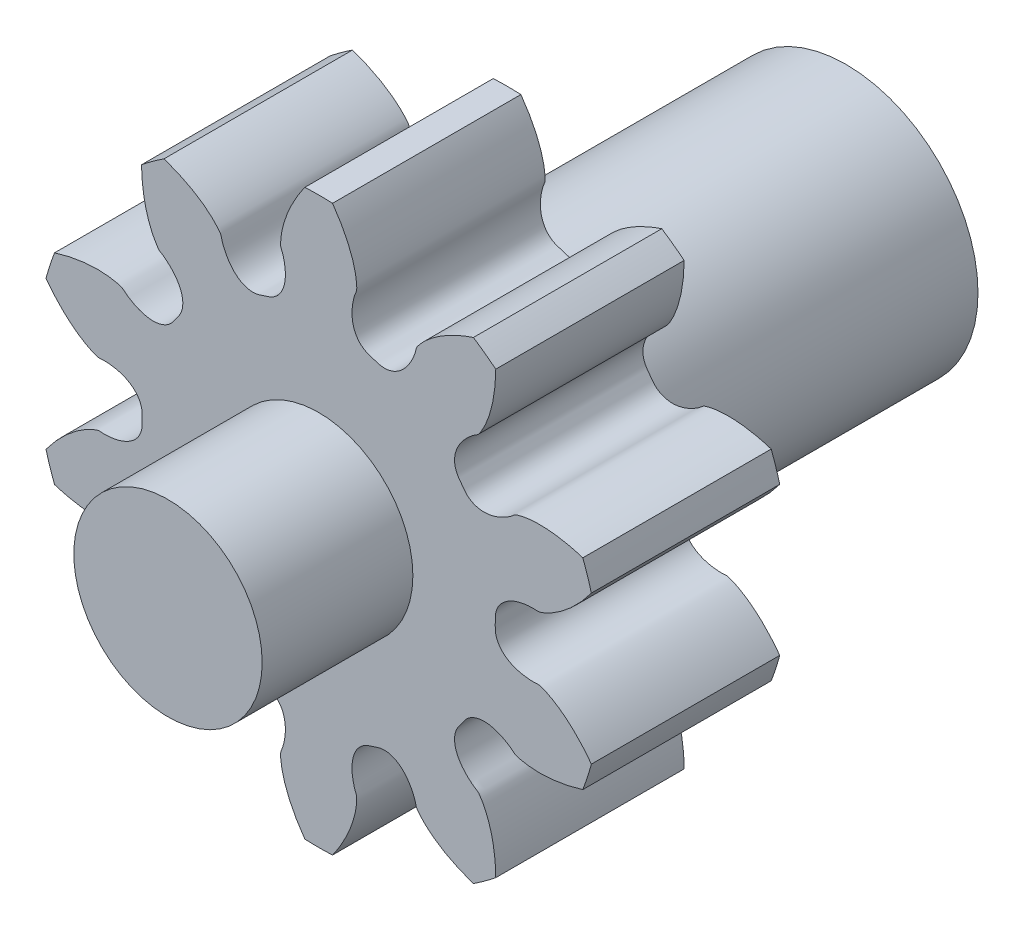
from build123d import *

# Parameters (mm, degrees)
SKETCHREVOLVESPURPINION_W       = 10
SKETCHREVOLVESPURPINION_H       = 15
TOOTHEXTRUDECUTSPURPINION_DEPTH = 5
PATTERNSPURPINION_COUNT         = 10
SKETCH3_R                       = 5
BOSS_EXTRUDE1_DEPTH             = 8
SKETCH4_R                       = 7
BOSS_EXTRUDE2_DEPTH             = 18
CUT_EXTRUDE2_DEPTH              = 15


with BuildPart() as part:
    # SketchRevolveSpurPinion → SpurPinion (revolve)
    with BuildSketch(Plane(origin=(0, 0, 0), x_dir=(0, 0, -1), z_dir=(1, 0, 0)), mode=Mode.PRIVATE) as spurpinion_sk:
        with Locations((0, 7.5)):
            Rectangle(SKETCHREVOLVESPURPINION_W, SKETCHREVOLVESPURPINION_H)
    revolve(spurpinion_sk.sketch.rotate(Axis((0, 0, 0), (0, 0, -1)), 90), axis=Axis((0, 0, 0), (0, 0, -1)))

    # SketchToothSpurPinion → ToothExtrudeCutSpurPinion (cut, symmetric)
    with BuildSketch(Plane.XY):
        with BuildLine():
            ThreePointArc((14.569567696, 4.061197133), (15.125, 0), (14.569567696, -4.061197133))
            add(Edge.make_bspline(
                [(14.569567696, -4.061197133), (14.427859874, -3.861632553), (14.209673665, -3.578045748), (13.904418686, -3.22876315), (13.684999286, -2.997332339), (13.470240269, -2.788455698), (13.261586972, -2.601352826), (13.060428263, -2.435163887), (12.868092511, -2.288952382), (12.685843528, -2.161712646), (12.514877767, -2.05236001), (12.356318142, -1.959778869), (12.211219584, -1.882685067), (12.080538286, -1.820076681), (11.965214456, -1.769860456), (11.842832435, -1.724424039), (11.649179793, -1.649342105), (11.434569911, -1.696941934), (11.239080863, -1.683850658), (11.11883073, -1.675708103), (11.001574361, -1.662620506), (10.887187648, -1.645922904), (10.775720498, -1.625282664), (10.667170857, -1.600776991), (10.561545218, -1.572348483), (10.458845742, -1.53994129), (10.359077942, -1.503459489), (10.262255057, -1.462771216), (10.16840608, -1.417700573), (10.077586537, -1.368023104), (9.989893335, -1.3134618), (9.905484435, -1.253686303), (9.824604013, -1.188317439), (9.747613068, -1.116940646), (9.675023698, -1.039132755), (9.607533684, -0.954507059), (9.546050385, -0.862780951), (9.49170341, -0.763865715), (9.445785092, -0.657974866), (9.409779592, -0.545719815), (9.384800939, -0.428213973), (9.374373909, -0.320691454), (9.370444082, -0.177657223), (9.378345923, 0), (9.370444082, 0.177657223), (9.374373909, 0.320691454), (9.384800939, 0.428213973), (9.409779592, 0.545719815), (9.445785092, 0.657974866), (9.49170341, 0.763865715), (9.546050385, 0.862780951), (9.607533684, 0.954507059), (9.675023698, 1.039132755), (9.747613068, 1.116940646), (9.824604013, 1.188317439), (9.905484435, 1.253686303), (9.989893335, 1.3134618), (10.077586537, 1.368023104), (10.16840608, 1.417700573), (10.262255057, 1.462771216), (10.359077942, 1.503459489), (10.458845742, 1.53994129), (10.561545218, 1.572348483), (10.667170857, 1.600776991), (10.775720498, 1.625282664), (10.887187648, 1.645922904), (11.001574361, 1.662620506), (11.11883073, 1.675708103), (11.239080863, 1.683850658), (11.434569911, 1.696941934), (11.649179793, 1.649342105), (11.842832435, 1.724424039), (11.965214456, 1.769860456), (12.080538286, 1.820076681), (12.211219584, 1.882685067), (12.356318142, 1.959778869), (12.514877767, 2.05236001), (12.685843528, 2.161712646), (12.868092511, 2.288952382), (13.060428263, 2.435163887), (13.261586972, 2.601352826), (13.470240269, 2.788455698), (13.684999286, 2.997332339), (13.904418686, 3.22876315), (14.209673665, 3.578045748), (14.427859874, 3.861632553), (14.569567696, 4.061197133)],
                knots=[0, 0, 0, 0, 0.05171016, 0.07552405, 0.097977146, 0.119069449, 0.138800958, 0.157171673, 0.174181594, 0.189830722, 0.204119057, 0.217046597, 0.228613344, 0.238819298, 0.247664458, 0.255148825, 0.266491119, 0.290788773, 0.29945532, 0.307936773, 0.316241042, 0.324377015, 0.332354693, 0.340185343, 0.347881664, 0.355457971, 0.362930389, 0.370317039, 0.377638219, 0.384916533, 0.392176948, 0.399446703, 0.406754997, 0.414132351, 0.421609511, 0.429215785, 0.43697672, 0.444911182, 0.453028093, 0.461323375, 0.469777943, 0.478357658, 0.484105593, 0.5, 0.515894407, 0.521642342, 0.530222057, 0.538676625, 0.546971907, 0.555088818, 0.56302328, 0.570784215, 0.578390489, 0.585867649, 0.593245003, 0.600553297, 0.607823052, 0.615083467, 0.622361781, 0.629682961, 0.637069611, 0.644542029, 0.652118336, 0.659814657, 0.667645307, 0.675622985, 0.683758958, 0.692063227, 0.70054468, 0.709211227, 0.733508881, 0.744851175, 0.752335542, 0.761180702, 0.771386656, 0.782953403, 0.795880943, 0.810169278, 0.825818406, 0.842828327, 0.861199042, 0.880930551, 0.902022854, 0.92447595, 0.94828984, 1, 1, 1, 1], degree=3))
        make_face()
    toothextrudecutspurpinion = extrude(amount=TOOTHEXTRUDECUTSPURPINION_DEPTH, both=True, mode=Mode.SUBTRACT)

    # PatternSpurPinion: ToothExtrudeCutSpurPinion ×10 about axis
    patternspurpinion_axis = Axis((0, 0, 55), (0, 0, -1))
    for i in range(1, PATTERNSPURPINION_COUNT):
        add(toothextrudecutspurpinion.rotate(patternspurpinion_axis, i * 360 / PATTERNSPURPINION_COUNT), mode=Mode.SUBTRACT)

    # Sketch3 → Boss-Extrude1 (add)
    with BuildSketch(Plane.XY.offset(5)):
        Circle(SKETCH3_R)
    extrude(amount=BOSS_EXTRUDE1_DEPTH)

    # Sketch4 → Boss-Extrude2 (add)
    with BuildSketch(Plane(origin=(0, 0, -5), x_dir=(-1, 0, 0), z_dir=(0, 0, -1))):
        Circle(SKETCH4_R)
    extrude(amount=BOSS_EXTRUDE2_DEPTH)

    # Sketch6 → Cut-Extrude2 (cut)
    with BuildSketch(Plane(origin=(0, 0, -23), x_dir=(-1, 0, 0), z_dir=(0, 0, -1))):
        with BuildLine():
            Line((-2.645751311, -3), (2.645751311, -3))
            ThreePointArc((2.645751311, -3), (0, 4), (-2.645751311, -3))
        make_face()
    extrude(amount=-CUT_EXTRUDE2_DEPTH, mode=Mode.SUBTRACT)


solid = part.part
